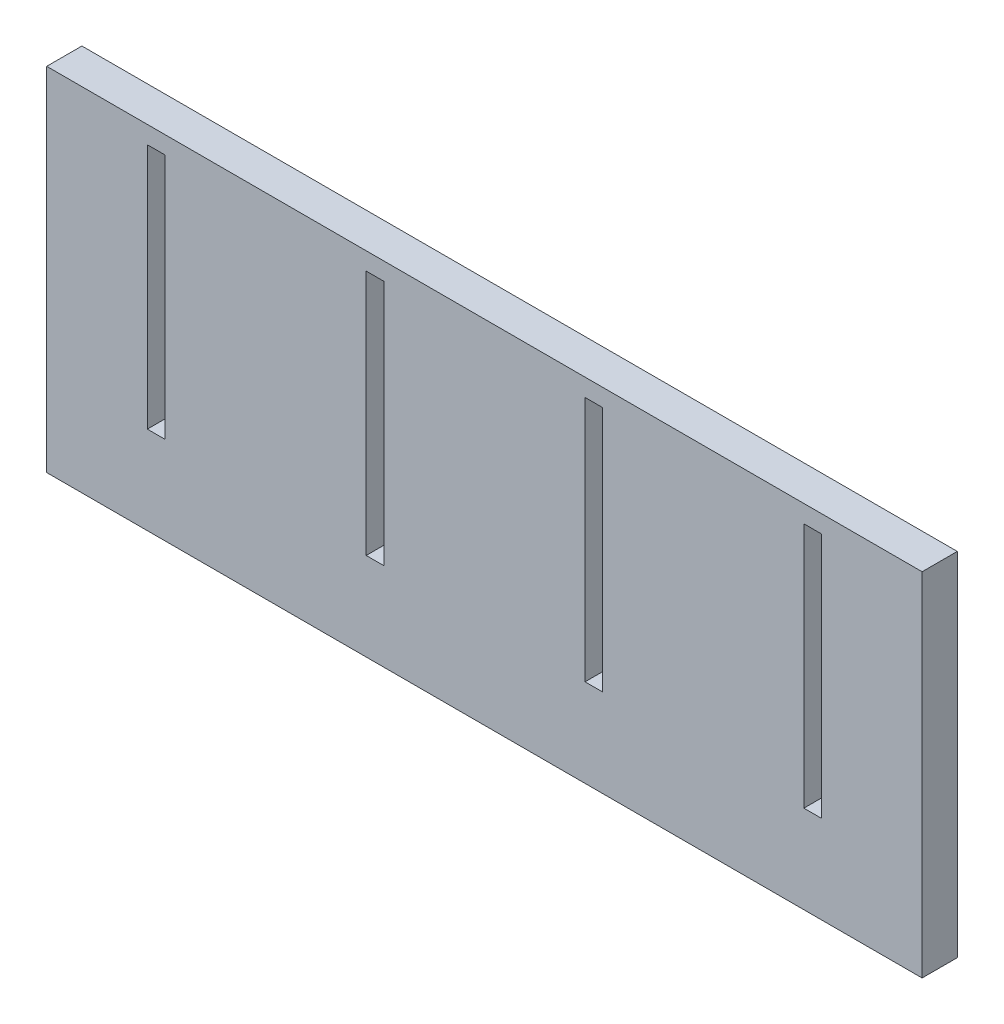
from build123d import *

# Parameters (mm, degrees)
SKETCH1_W           = 5
SKETCH1_H           = 70
BOSS_EXTRUDE1_DEPTH = 10


with BuildPart() as part:
    # Sketch1 → Boss-Extrude1 (new body)
    with BuildSketch(Plane.XY):
        Polygon((-124.392981478, -115.783921891), (0, -115.783921891), (124.407018522, -115.783921891), (124.407018522, -15.783921891), (-0.05047515, -15.783921891), (-124.392981478, -15.783921891), align=None)
        with Locations((-31.092981478, -55.783921891)):
            Rectangle(SKETCH1_W, SKETCH1_H, mode=Mode.SUBTRACT)
        with Locations((-93.292981478, -55.783921891)):
            Rectangle(SKETCH1_W, SKETCH1_H, mode=Mode.SUBTRACT)
        with Locations((31.107018522, -55.783921891)):
            Rectangle(SKETCH1_W, SKETCH1_H, mode=Mode.SUBTRACT)
        with Locations((93.307018522, -55.783921891)):
            Rectangle(SKETCH1_W, SKETCH1_H, mode=Mode.SUBTRACT)
    extrude(amount=BOSS_EXTRUDE1_DEPTH)


solid = part.part
